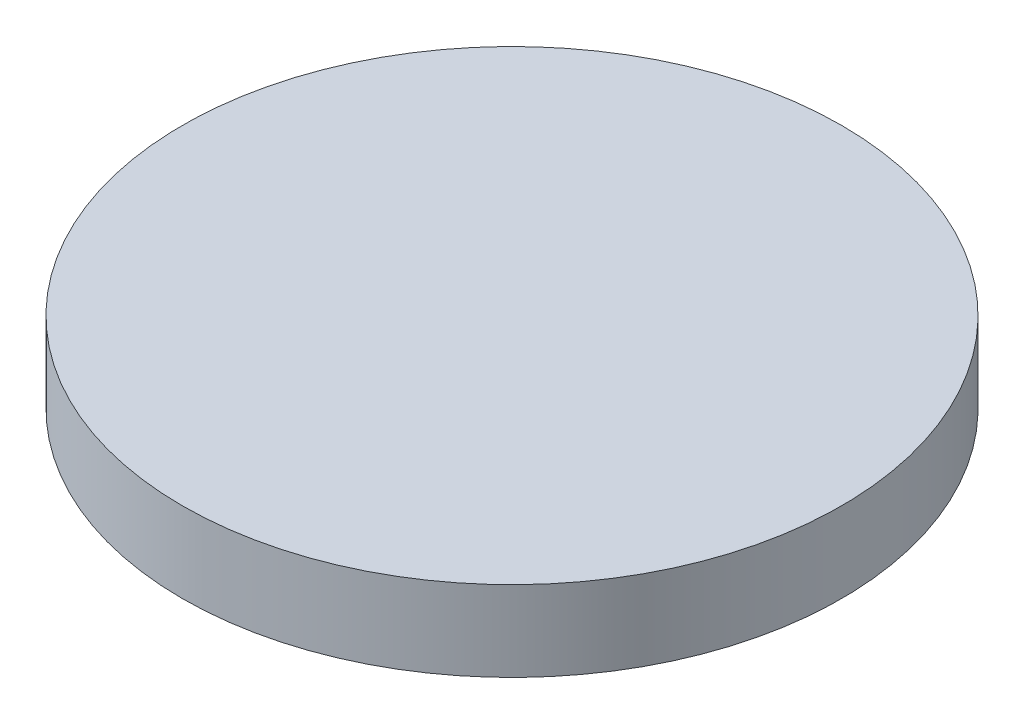
from build123d import *

# Parameters (mm, degrees)
SKETCH1_R           = 20.5
BOSS_EXTRUDE1_DEPTH = 5


with BuildPart() as part:
    # Sketch1 → Boss-Extrude1 (new body)
    with BuildSketch(Plane(origin=(0, 0, 0), x_dir=(1, 0, 0), z_dir=(0, 1, 0))):
        with Locations(Location((0, 0, 0), (0, 0, 270))):
            Circle(SKETCH1_R)
    extrude(amount=BOSS_EXTRUDE1_DEPTH)


solid = part.part
